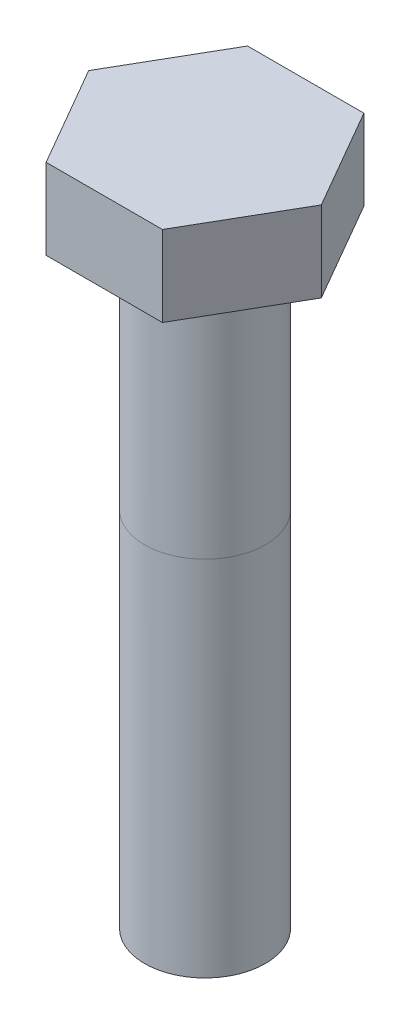
from build123d import *

# Parameters (mm, degrees)
EXTRUDE_1_DEPTH = 4
SKETCH_2_R      = 3
EXTRUDE_2_DEPTH = 30


with BuildPart() as part:
    # Эскиз1 → Бобышка-Вытянуть1 (new body)
    with BuildSketch(Plane(origin=(0, 0, 0), x_dir=(1, 0, 0), z_dir=(0, 1, 0))):
        Polygon((5.773502692, 0), (2.886751346, 5), (-2.886751346, 5), (-5.773502692, 0), (-2.886751346, -5), (2.886751346, -5), align=None)
    extrude(amount=EXTRUDE_1_DEPTH)

    # Эскиз2 → Бобышка-Вытянуть2 (add)
    with BuildSketch(Plane.XZ):
        with Locations(Location((0, 0, 0), (0, 0, 270))):
            Circle(SKETCH_2_R)
    extrude(amount=EXTRUDE_2_DEPTH)


solid = part.part
